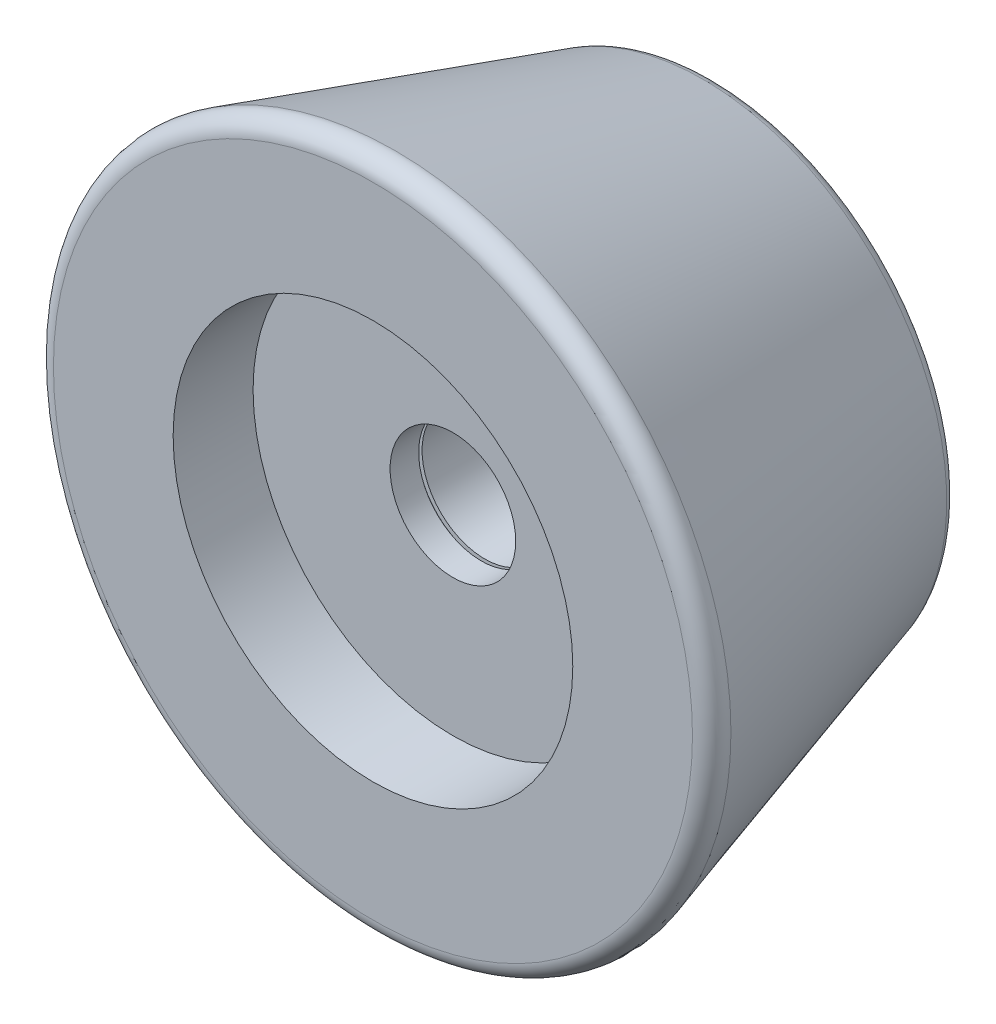
from build123d import *

# Parameters (mm, degrees)
FILLET1_R = 0.75


with BuildPart() as part:
    # Sketch2 → Revolve1 (revolve)
    with BuildSketch(Plane(origin=(0, 0, 0), x_dir=(1, 0, 0), z_dir=(0, 1, 0))):
        Polygon((5.125, 0), (10.5, 0), (15, -15), (8.75, -15), (8.75, -11.5), (2.75, -11.5), (2.75, -10.25), (2.95, -10.25), (2.95, -10.1), (2.75, -10.1), (2.75, -3.25), (5.125, -3.25), align=None)
    revolve(axis=Axis((0, 0, 0), (0, 0, -1)))

    # Fillet1
    fillet1_edges = [part.edges().sort_by_distance(p)[0] for p in [
        (-10.5, 0, 0),
        (-15, 0, 15),
    ]]
    fillet(fillet1_edges, radius=FILLET1_R)


solid = part.part
